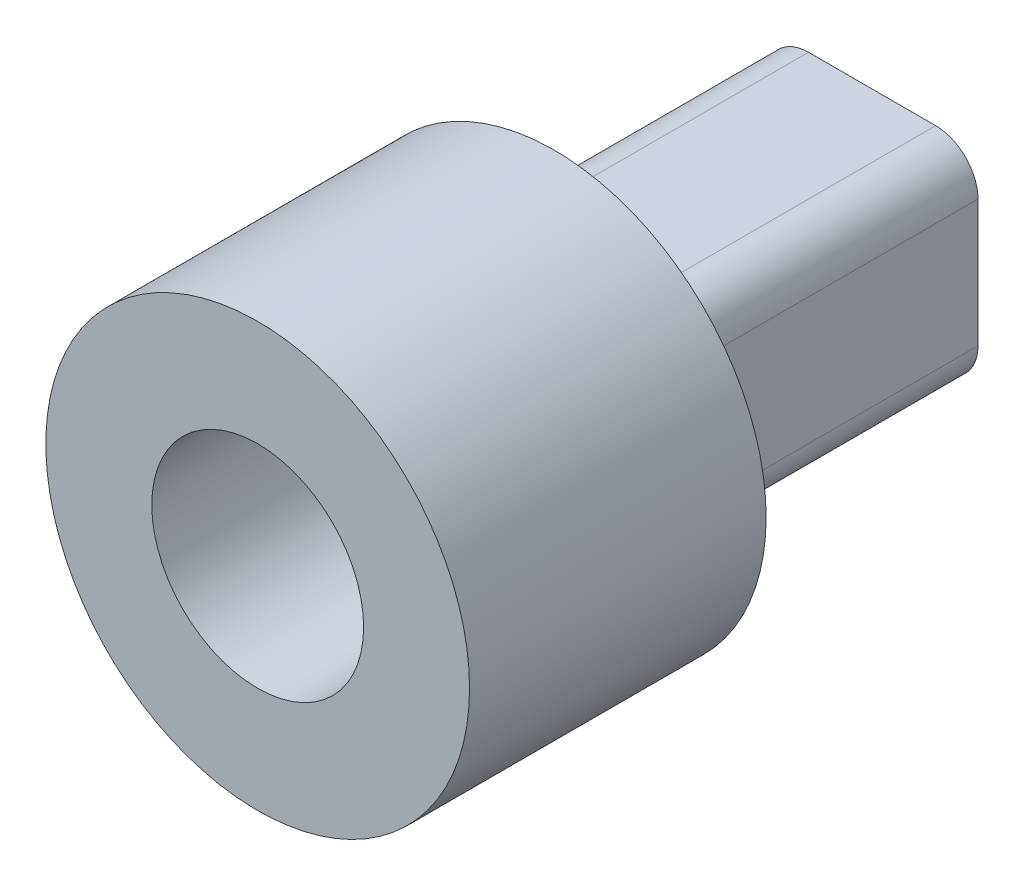
from build123d import *

# Parameters (mm, degrees)
BOSS_EXTRUDE1_DEPTH = 7.5
SKETCH2_R           = 5
BOSS_EXTRUDE2_DEPTH = 2
SKETCH3_R           = 5
SKETCH3_R_2         = 2.5
BOSS_EXTRUDE3_DEPTH = 5
FILLET1_R           = 1


with BuildPart() as part:
    # Sketch1 → Boss-Extrude1 (new body)
    with BuildSketch(Plane.XY):
        with BuildLine():
            Line((-1.5, -2.5), (1.5, -2.5))
            ThreePointArc((1.5, -2.5), (2.207106781, -2.207106781), (2.5, -1.5))
            Line((2.5, -1.5), (2.5, 1.5))
            ThreePointArc((2.5, 1.5), (2.207106781, 2.207106781), (1.5, 2.5))
            Line((1.5, 2.5), (-1.5, 2.5))
            ThreePointArc((-1.5, 2.5), (-2.207106781, 2.207106781), (-2.5, 1.5))
            Line((-2.5, 1.5), (-2.5, -1.5))
            ThreePointArc((-2.5, -1.5), (-2.207106781, -2.207106781), (-1.5, -2.5))
        make_face()
    extrude(amount=BOSS_EXTRUDE1_DEPTH)

    # Sketch2 → Boss-Extrude2 (add)
    with BuildSketch(Plane.XY.offset(7.5)):
        Circle(SKETCH2_R)
    extrude(amount=BOSS_EXTRUDE2_DEPTH)

    # Sketch3 → Boss-Extrude3 (add)
    with BuildSketch(Plane.XY.offset(9.5)):
        Circle(SKETCH3_R)
        Circle(SKETCH3_R_2, mode=Mode.SUBTRACT)
    extrude(amount=BOSS_EXTRUDE3_DEPTH)

    # Fillet1
    fillet1_edges = [part.edges().sort_by_distance(p)[0] for p in [
        (-2.207106781, 2.207106781, 7.5),
        (-2.5, 0, 7.5),
        (-2.207106781, -2.207106781, 7.5),
        (0, -2.5, 7.5),
        (2.207106781, -2.207106781, 7.5),
        (2.5, 0, 7.5),
        (2.207106781, 2.207106781, 7.5),
        (0, 2.5, 7.5),
    ]]
    fillet(fillet1_edges, radius=FILLET1_R)


solid = part.part
